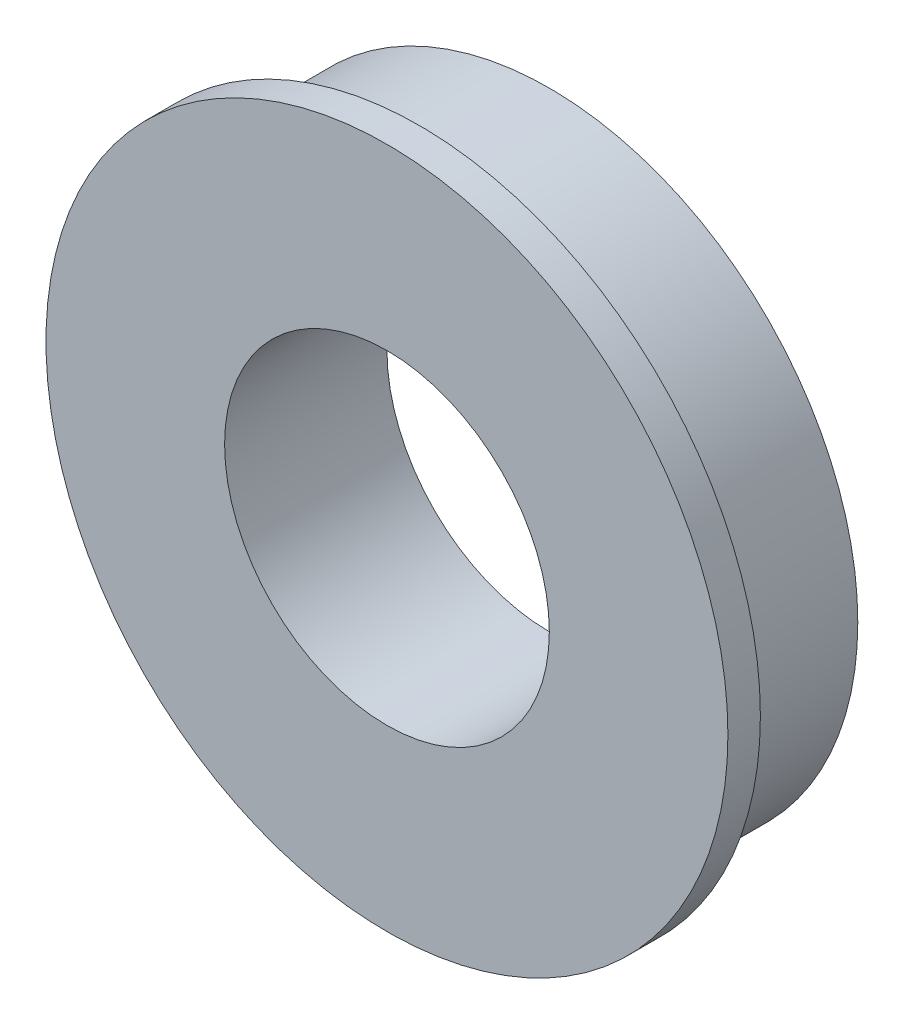
from build123d import *

# Parameters (mm, degrees)
SKETCH_1_R      = 9.5
SKETCH_1_R_2    = 5
EXTRUDE_1_DEPTH = 4
SKETCH_2_R      = 10.5
SKETCH_2_R_2    = 5
EXTRUDE_2_DEPTH = 1


with BuildPart() as part:
    # 草图1 → 凸台-拉伸1 (new body)
    with BuildSketch(Plane.XY):
        Circle(SKETCH_1_R)
        Circle(SKETCH_1_R_2, mode=Mode.SUBTRACT)
    extrude(amount=EXTRUDE_1_DEPTH)

    # 草图2 → 凸台-拉伸2 (add)
    with BuildSketch(Plane.XY.offset(4)):
        Circle(SKETCH_2_R)
        Circle(SKETCH_2_R_2, mode=Mode.SUBTRACT)
    extrude(amount=EXTRUDE_2_DEPTH)


solid = part.part
